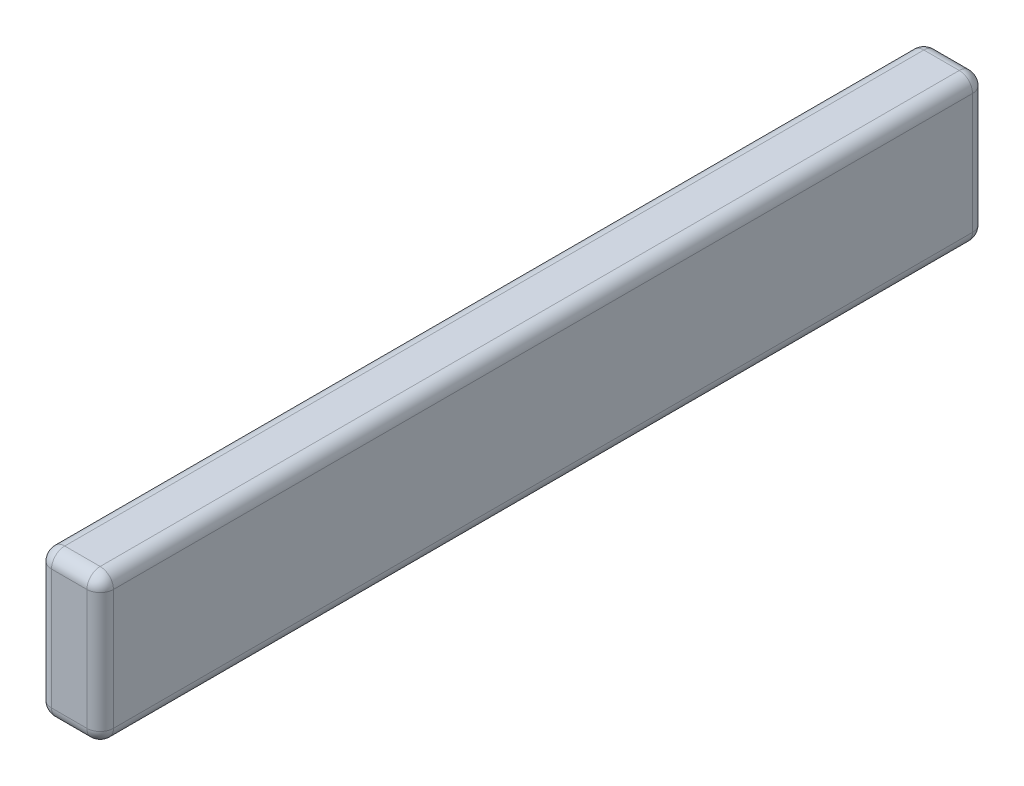
from build123d import *

# Parameters (mm, degrees)
SKETCH1_W           = 2000
SKETCH1_H           = 331.6
BOSS_EXTRUDE1_DEPTH = 140
FILLET1_R           = 30


with BuildPart() as part:
    # Sketch1 → Boss-Extrude1 (new body)
    with BuildSketch(Plane(origin=(0, 0, 0), x_dir=(0, 0, -1), z_dir=(1, 0, 0))):
        Rectangle(SKETCH1_W, SKETCH1_H)
    extrude(amount=BOSS_EXTRUDE1_DEPTH)

    # Fillet1
    fillet1_edges = [part.edges().sort_by_distance(p)[0] for p in [
        (140, 0, -1000),
        (140, 165.8, 0),
        (140, 0, 1000),
        (0, 165.8, 0),
        (0, 0, -1000),
        (0, -165.8, 0),
        (0, 0, 1000),
        (70, 165.8, 1000),
        (70, 165.8, -1000),
        (70, -165.8, -1000),
        (70, -165.8, 1000),
        (140, -165.8, 0),
    ]]
    fillet(fillet1_edges, radius=FILLET1_R)


solid = part.part
